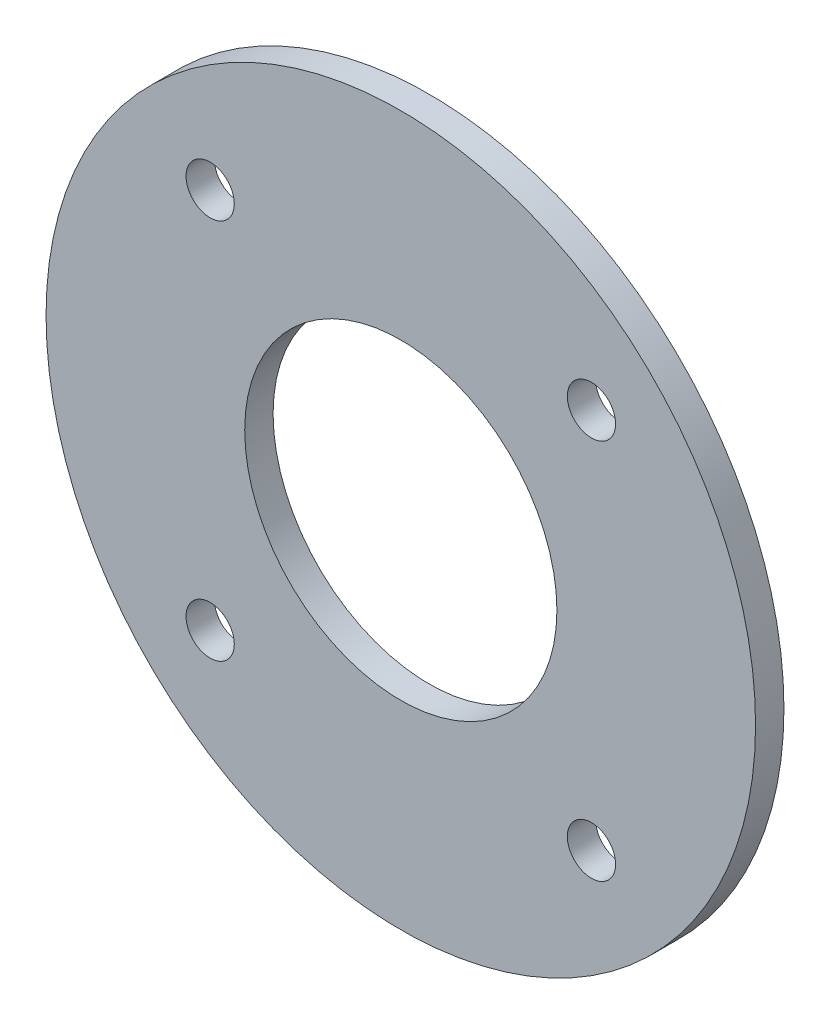
from build123d import *

# Parameters (mm, degrees)
BOSS_EXTRU_1_DEPTH      = 2
BOSS_EXTRU_1_DEPTH_BACK = 0.0001
ESQUISSE1_R             = 25
ESQUISSE1_R_2           = 1.7
ESQUISSE2_R             = 11
ENL_V_MAT_EXTRU_1_DEPTH = 10


with BuildPart() as part:
    # Esquisse1 → Boss.-Extru.1 (new, two sides: drawn at the far end of the back side and taken through both)
    with BuildSketch(Plane.XY.offset(-BOSS_EXTRU_1_DEPTH_BACK)):
        Circle(ESQUISSE1_R)
        with Locations((-13.435028843, 13.435028843)):
            Circle(ESQUISSE1_R_2, mode=Mode.SUBTRACT)
        with Locations((13.435028843, 13.435028843)):
            Circle(ESQUISSE1_R_2, mode=Mode.SUBTRACT)
        with Locations((13.435028843, -13.435028843)):
            Circle(ESQUISSE1_R_2, mode=Mode.SUBTRACT)
        with Locations((-13.435028843, -13.435028843)):
            Circle(ESQUISSE1_R_2, mode=Mode.SUBTRACT)
    extrude(amount=BOSS_EXTRU_1_DEPTH + BOSS_EXTRU_1_DEPTH_BACK)

    # Esquisse2 → Enlèv. mat.-Extru.1 (cut)
    with BuildSketch(Plane(origin=(0, 0, -0.0001), x_dir=(-1, 0, 0), z_dir=(0, 0, -1))):
        Circle(ESQUISSE2_R)
    extrude(amount=-ENL_V_MAT_EXTRU_1_DEPTH, mode=Mode.SUBTRACT)


solid = part.part
